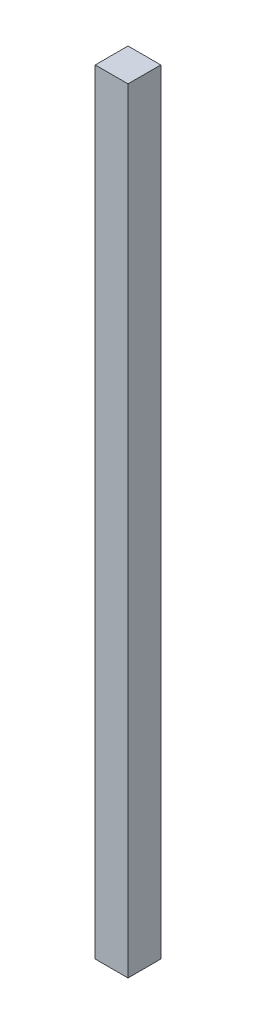
from build123d import *

# Parameters (mm, degrees)
SKETCH1_W           = 25.4
SKETCH1_H           = 25.4
BOSS_EXTRUDE1_DEPTH = 600


with BuildPart() as part:
    # Sketch1 → Boss-Extrude1 (new body)
    with BuildSketch(Plane(origin=(0, 0, 0), x_dir=(1, 0, 0), z_dir=(0, 1, 0))):
        with Locations((12.7, 12.7)):
            Rectangle(SKETCH1_W, SKETCH1_H)
    extrude(amount=BOSS_EXTRUDE1_DEPTH)


solid = part.part
